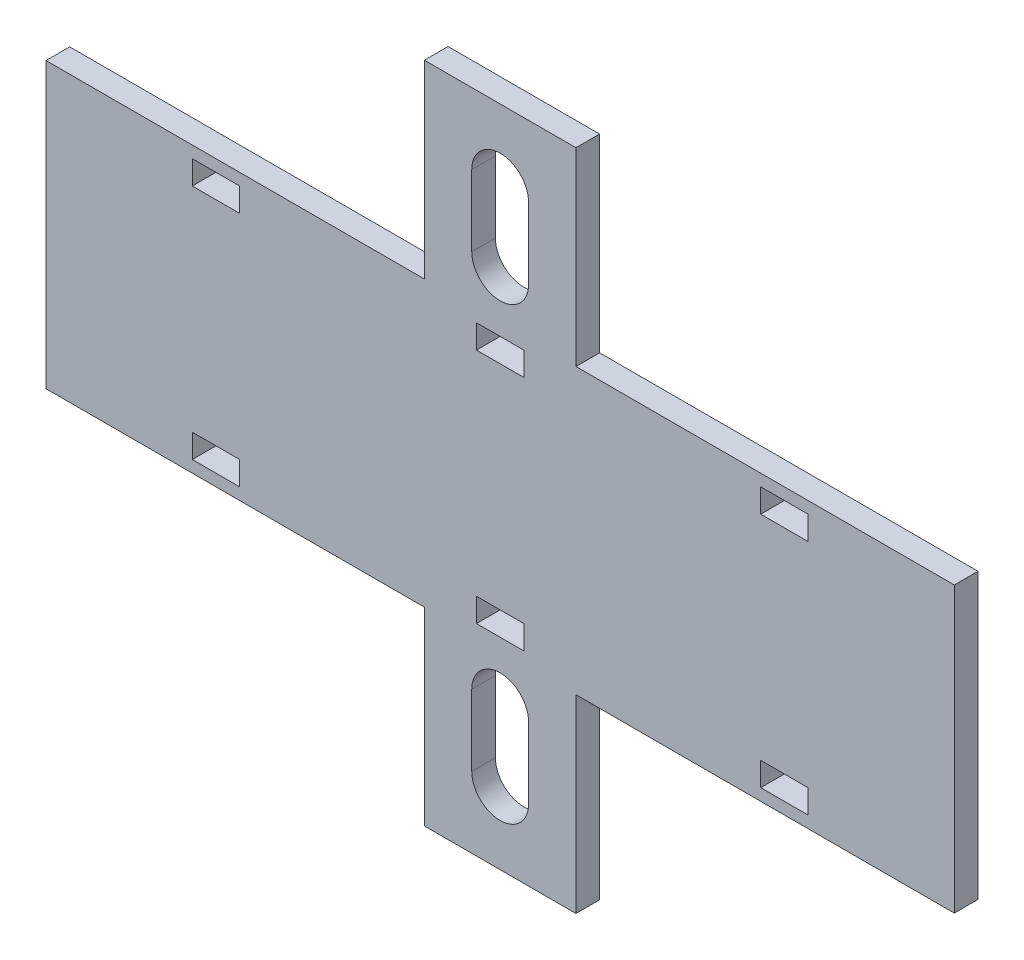
from build123d import *

# Parameters (mm, degrees)
SKETCH5_W           = 10
SKETCH5_H           = 5
BOSS_EXTRUDE2_DEPTH = 5


with BuildPart() as part:
    # Sketch5 → Boss-Extrude2 (new body)
    with BuildSketch(Plane.XY):
        Polygon((-16, -70), (16, -70), (16, -30), (95.875, -30), (95.875, 30), (16, 30), (16, 70), (-16, 70), (-16, 30), (-95.875, 30), (-95.875, -30), (-16, -30), align=None)
        with Locations((60, -25)):
            Rectangle(SKETCH5_W, SKETCH5_H, mode=Mode.SUBTRACT)
        with Locations((60, 25)):
            Rectangle(SKETCH5_W, SKETCH5_H, mode=Mode.SUBTRACT)
        with Locations((0, -25)):
            Rectangle(SKETCH5_W, SKETCH5_H, mode=Mode.SUBTRACT)
        with Locations((0, 25)):
            Rectangle(SKETCH5_W, SKETCH5_H, mode=Mode.SUBTRACT)
        with Locations((-60, 25)):
            Rectangle(SKETCH5_W, SKETCH5_H, mode=Mode.SUBTRACT)
        with Locations((-60, -25)):
            Rectangle(SKETCH5_W, SKETCH5_H, mode=Mode.SUBTRACT)
        with BuildLine():
            Line((6, 55), (6, 40))
            ThreePointArc((6, 40), (0, 34), (-6, 40))
            Line((-6, 40), (-6, 55))
            ThreePointArc((-6, 55), (0, 61), (6, 55))
        make_face(mode=Mode.SUBTRACT)
        with BuildLine():
            Line((-6, -40), (-6, -55))
            ThreePointArc((-6, -55), (0, -61), (6, -55))
            Line((6, -55), (6, -40))
            ThreePointArc((6, -40), (0, -34), (-6, -40))
        make_face(mode=Mode.SUBTRACT)
    extrude(amount=BOSS_EXTRUDE2_DEPTH)


solid = part.part
